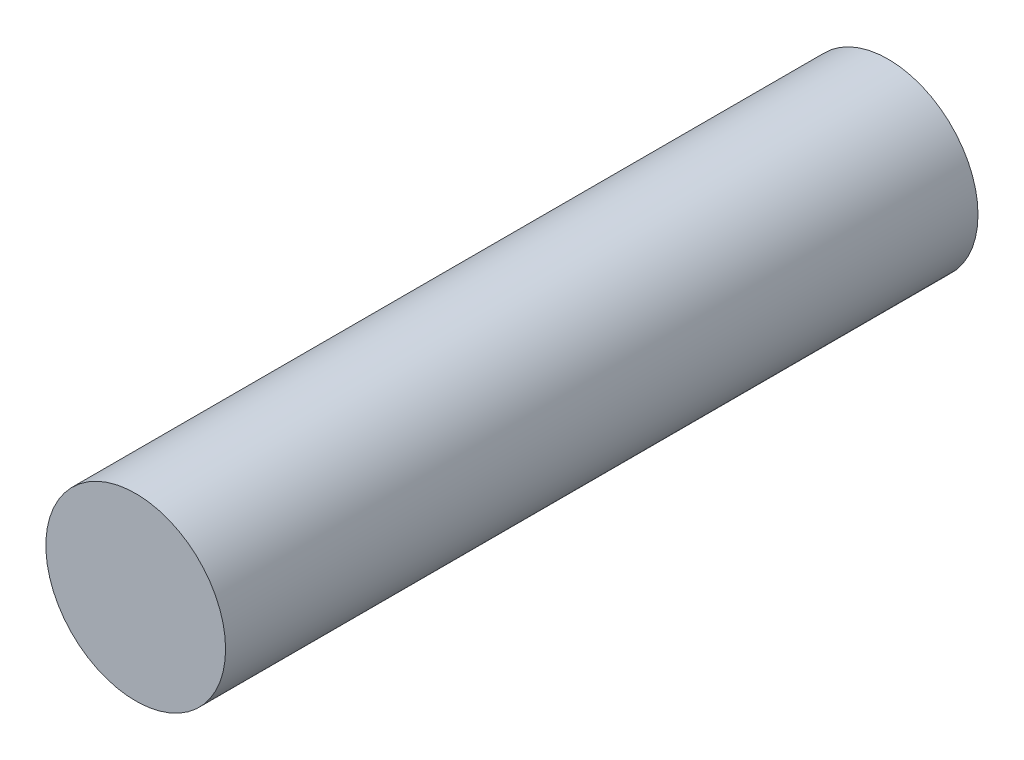
from build123d import *

# Parameters (mm, degrees)
SKETCH1_R           = 2.15
BOSS_EXTRUDE1_DEPTH = 18


with BuildPart() as part:
    # Sketch1 → Boss-Extrude1 (new body)
    with BuildSketch(Plane.XY):
        Circle(SKETCH1_R)
    extrude(amount=BOSS_EXTRUDE1_DEPTH)


solid = part.part
